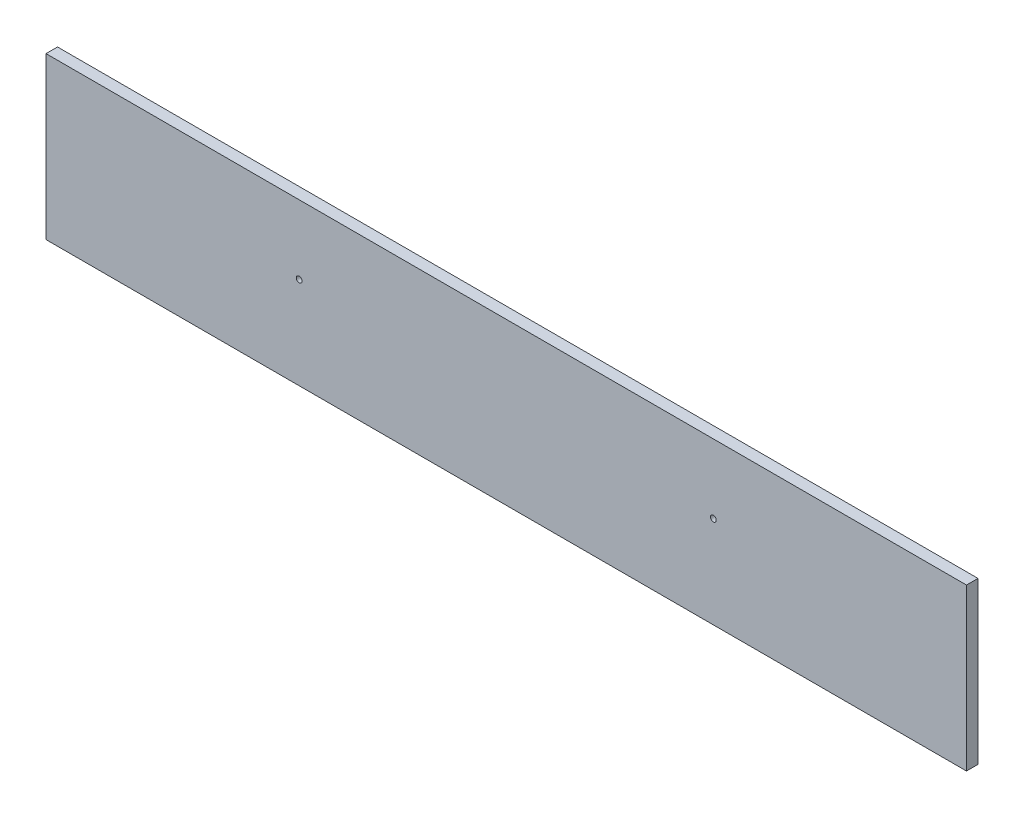
from build123d import *

# Parameters (mm, degrees)
SKETCH1_W           = 400
SKETCH1_H           = 70
SKETCH1_R           = 1.25
BOSS_EXTRUDE1_DEPTH = 5


with BuildPart() as part:
    # Sketch1 → Boss-Extrude1 (new body)
    with BuildSketch(Plane.XY):
        with Locations((0, -5)):
            Rectangle(SKETCH1_W, SKETCH1_H)
        with Locations((-90, 0)):
            Circle(SKETCH1_R, mode=Mode.SUBTRACT)
        with Locations(Location((90, 0, 0), (0, 0, 180))):
            Circle(SKETCH1_R, mode=Mode.SUBTRACT)
    extrude(amount=BOSS_EXTRUDE1_DEPTH)


solid = part.part
